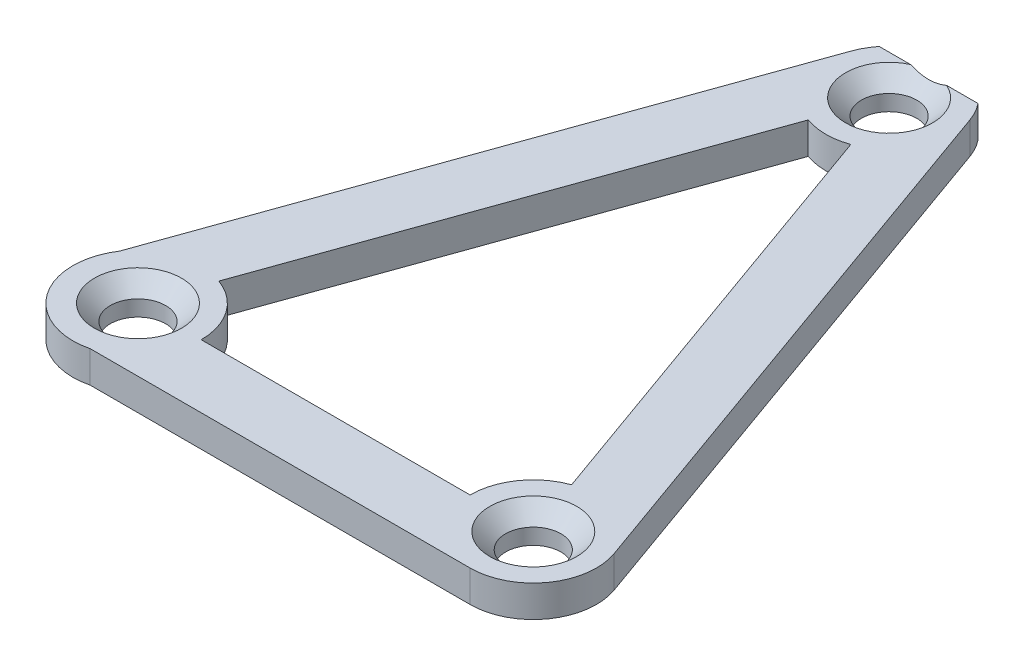
from build123d import *

# Parameters (mm, degrees)
IZIM2_R                     = 1.75
Y_KSEKLIK_EKSTR_ZYON1_DEPTH = 2
PAH1_SIZE                   = 1
IZIM3_W                     = 10
IZIM3_H                     = 1.5
KES_EKSTR_ZYON1_DEPTH       = 10


with BuildPart() as part:
    # Çizim2 → Yükseklik-Ekstrüzyon1 (new body)
    with BuildSketch(Plane(origin=(0, 0, 0), x_dir=(1, 0, 0), z_dir=(0, 1, 0))):
        with BuildLine():
            Line((19.655461919, 42.650157531), (32.155461919, 7.650157531))
            ThreePointArc((32.155461919, 7.650157531), (31.658156515, 4.000618196), (28.388494273, 2.304811943))
            Line((28.388494273, 2.304811943), (4.365814172, 2.304811943))
            ThreePointArc((4.365814172, 2.304811943), (0.022651908, 3.932838217), (-0.04976512, 8.570540641))
            Line((-0.04976512, 8.570540641), (12.121526627, 42.650157531))
            ThreePointArc((12.121526627, 42.650157531), (15.888494273, 45.304811943), (19.655461919, 42.650157531))
        make_face()
        with Locations(Location((3.388494273, 6.304811943, 0), (0, 0, 270))):
            Circle(IZIM2_R, mode=Mode.SUBTRACT)
        with Locations(Location((28.388494273, 6.304811943, 0), (0, 0, 270))):
            Circle(IZIM2_R, mode=Mode.SUBTRACT)
        with Locations(Location((15.888494273, 41.304811943, 0), (0, 0, 270))):
            Circle(IZIM2_R, mode=Mode.SUBTRACT)
        with BuildLine():
            Line((14.543148685, 37.537844297), (4.733839861, 10.07177959))
            ThreePointArc((4.733839861, 10.07177959), (6.658156515, 8.60900569), (7.388494273, 6.304811943))
            Line((7.388494273, 6.304811943), (24.388494273, 6.304811943))
            ThreePointArc((24.388494273, 6.304811943), (25.118832031, 8.60900569), (27.043148685, 10.07177959))
            Line((27.043148685, 10.07177959), (17.233839861, 37.537844297))
            ThreePointArc((17.233839861, 37.537844297), (15.888494273, 37.304811943), (14.543148685, 37.537844297))
        make_face(mode=Mode.SUBTRACT)
    extrude(amount=Y_KSEKLIK_EKSTR_ZYON1_DEPTH)

    # Pah1
    pah1_edges = [part.edges().sort_by_distance(p)[0] for p in [
        (3.388494273, 2, -8.054811943),
        (28.388494273, 2, -8.054811943),
        (15.888494273, 2, -43.054811943),
    ]]
    chamfer(pah1_edges, length=PAH1_SIZE)

    # Çizim3 → Kes-Ekstrüzyon1 (cut)
    with BuildSketch(Plane(origin=(0, 2, 0), x_dir=(1, 0, 0), z_dir=(0, 1, 0))):
        with Locations((15.888494273, 44.554811943)):
            Rectangle(IZIM3_W, IZIM3_H)
    extrude(amount=-KES_EKSTR_ZYON1_DEPTH, mode=Mode.SUBTRACT)


solid = part.part
